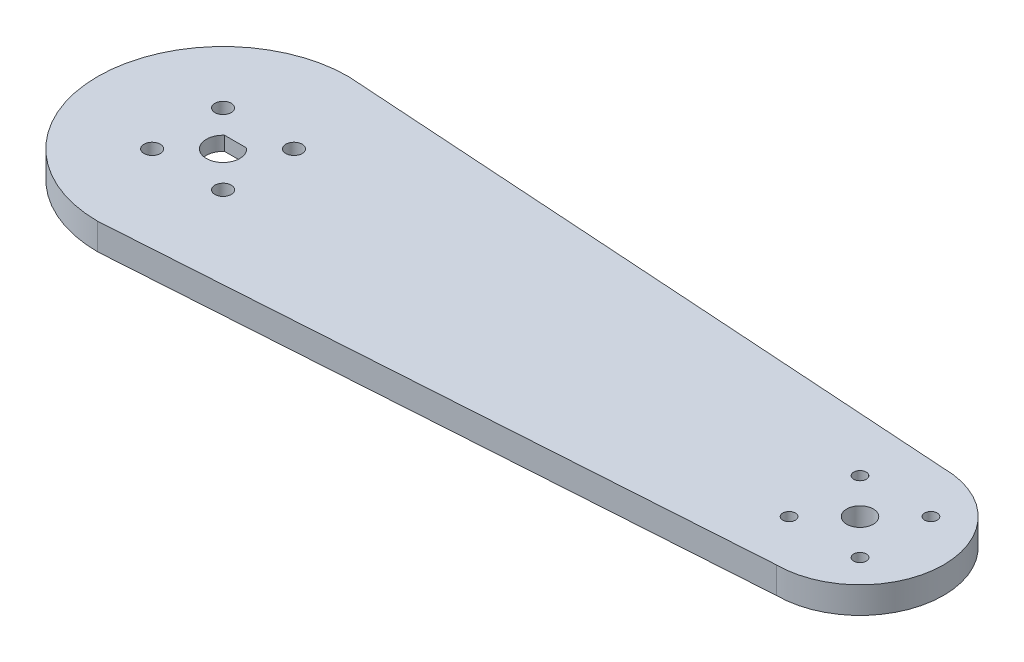
from build123d import *

# Parameters (mm, degrees)
SKETCH2_R             = 20
BOSS_EXTRUDE1_DEPTH   = 6.35
SKETCH11_R            = 3.175
CUT_EXTRUDE1_DEPTH    = 10
CUT_EXTRUDE2_START    = -6.35
SKETCH12_R            = 16
CUT_EXTRUDE2_DEPTH    = 3
SKETCH13_R            = 1.95
CUT_EXTRUDE3_DEPTH    = 176.022805657
F_3_0MM_DOWEL_HOLE1_D = 3
CIRPATTERN1_COUNT     = 4


with BuildPart() as part:
    # Sketch2 → Boss-Extrude1 (new body)
    # profile 1 of 3: a face of its own
    with BuildSketch(Plane(origin=(0, 0, 0), x_dir=(1, 0, 0), z_dir=(0, 1, 0))):
        with BuildLine():
            Line((152.4, 20), (3.920129505, 29.742773655))
            ThreePointArc((3.920129505, 29.742773655), (22.556638548, 19.778727397), (30, 0))
            ThreePointArc((30, 0), (22.556638548, -19.778727397), (3.920129505, -29.742773655))
            Line((3.920129505, -29.742773655), (152.4, -20))
            ThreePointArc((152.4, -20), (132.4, 0), (152.4, 20))
        make_face()
    # profile 2 of 3: a face of its own
    with BuildSketch(Plane(origin=(0, 0, 0), x_dir=(1, 0, 0), z_dir=(0, 1, 0))):
        with BuildLine():
            Line((3.920129505, 29.742773655), (0, 30))
            ThreePointArc((0, 30), (-30, 0), (0, -30))
            Line((0, -30), (3.920129505, -29.742773655))
            ThreePointArc((3.920129505, -29.742773655), (22.556638548, -19.778727397), (30, 0))
            ThreePointArc((30, 0), (22.556638548, 19.778727397), (3.920129505, 29.742773655))
        make_face()
        with BuildLine():
            ThreePointArc((2.645751311, 3), (0, -4), (-2.645751311, 3))
            Line((-2.645751311, 3), (2.645751311, 3))
        make_face(mode=Mode.SUBTRACT)
    # profile 3 of 3: a face of its own
    with BuildSketch(Plane(origin=(0, 0, 0), x_dir=(1, 0, 0), z_dir=(0, 1, 0))):
        with Locations((152.4, 0)):
            Circle(SKETCH2_R)
    extrude(amount=BOSS_EXTRUDE1_DEPTH)

    # Sketch11 → Cut-Extrude1 (cut)
    with BuildSketch(Plane(origin=(0, 6.35, 0), x_dir=(1, 0, 0), z_dir=(0, 1, 0))):
        with Locations(Location((152.4, 0, 0), (0, 0, 270))):
            Circle(SKETCH11_R)
    extrude(amount=-CUT_EXTRUDE1_DEPTH, mode=Mode.SUBTRACT)

    # Sketch12 → Cut-Extrude2 (cut)
    with BuildSketch(Plane(origin=(0, 6.35, 0), x_dir=(1, 0, 0), z_dir=(0, 1, 0)).offset(CUT_EXTRUDE2_START)):
        with Locations(Location((0, 0, 0), (0, 0, 270))):
            Circle(SKETCH12_R)
    extrude(amount=CUT_EXTRUDE2_DEPTH, mode=Mode.SUBTRACT)

    # Sketch13 → Cut-Extrude3 (cut, through all)
    with BuildSketch(Plane(origin=(0, 3, 0), x_dir=(-1, 0, 0), z_dir=(0, -1, 0))):
        with Locations(Location((-8.485281374, 8.485281374, 0), (0, 0, 90))):
            Circle(SKETCH13_R)
        with Locations(Location((8.485281374, 8.485281374, 0), (0, 0, 90))):
            Circle(SKETCH13_R)
        with Locations(Location((8.485281374, -8.485281374, 0), (0, 0, 90))):
            Circle(SKETCH13_R)
        with Locations(Location((-8.485281374, -8.485281374, 0), (0, 0, 90))):
            Circle(SKETCH13_R)
    extrude(amount=-CUT_EXTRUDE3_DEPTH, mode=Mode.SUBTRACT)

    # Ø3.0mm Dowel Hole1 (through all)
    with Locations(Plane(origin=(0, 0, 0), x_dir=(-1, 0, 0), z_dir=(0, -1, 0))):
        with Locations((-160.885281374, -8.485281374)):
            f_3_0mm_dowel_hole1 = Hole(F_3_0MM_DOWEL_HOLE1_D / 2)

    # CirPattern1: Ø3.0mm Dowel Hole1 ×4 about axis
    cirpattern1_axis = Axis((152.4, 0, 0), (0, 1, 0))
    for i in range(1, CIRPATTERN1_COUNT):
        add(f_3_0mm_dowel_hole1.rotate(cirpattern1_axis, i * 360 / CIRPATTERN1_COUNT), mode=Mode.SUBTRACT)


solid = part.part
